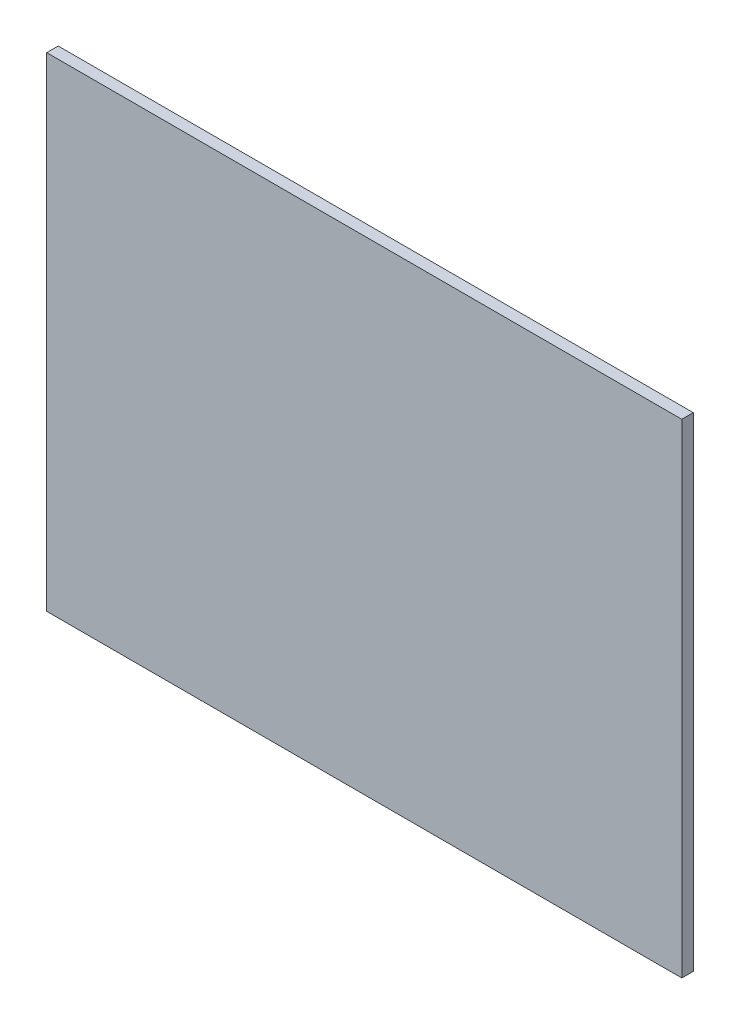
from build123d import *

# Parameters (mm, degrees)
SKIZZE1_W                       = 1050
SKIZZE1_H                       = 800
AUFSATZ_LINEAR_AUSTRAGEN1_DEPTH = 9.5


with BuildPart() as part:
    # Skizze1 → Aufsatz-Linear austragen1 (new, symmetric)
    with BuildSketch(Plane.XY):
        Rectangle(SKIZZE1_W, SKIZZE1_H)
    extrude(amount=AUFSATZ_LINEAR_AUSTRAGEN1_DEPTH, both=True)


solid = part.part
